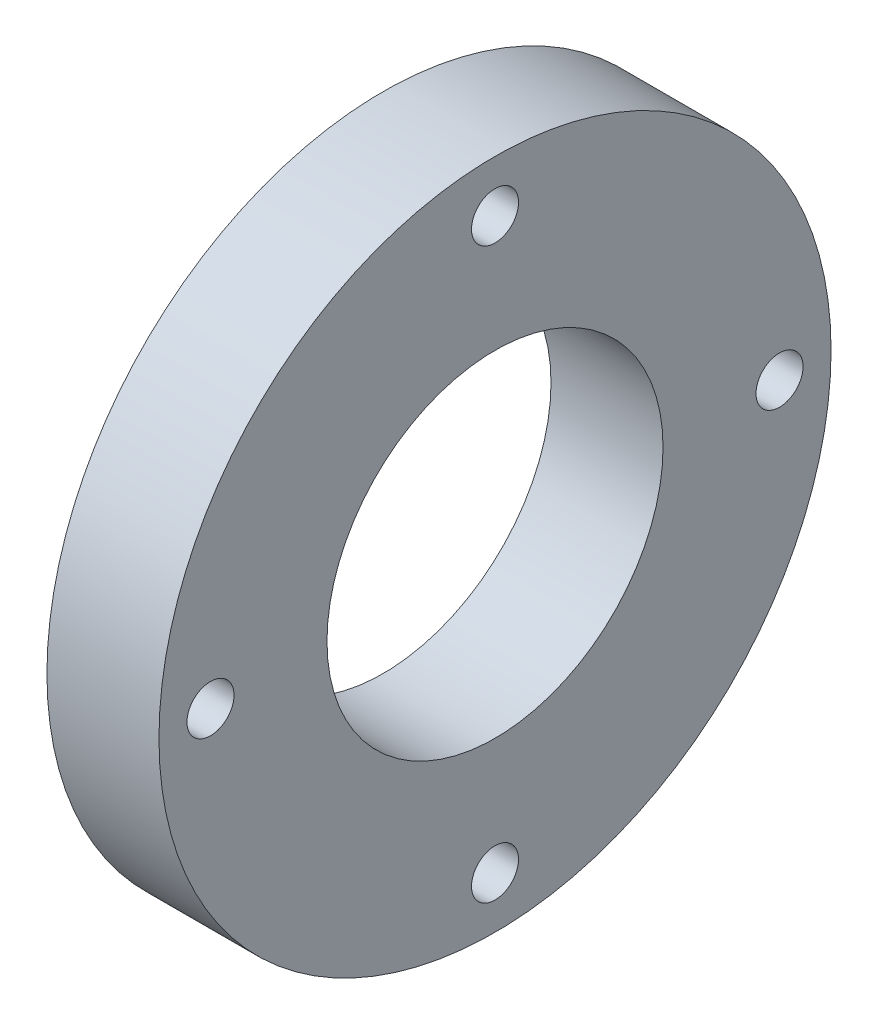
from build123d import *

# Parameters (mm, degrees)
SKETCH1_W                      = 5
SKETCH1_H                      = 15
F_15_0_15_DIAMETER_HOLE1_D     = 15
F_2_1_2_1_DIAMETER_HOLE1_D     = 2.1
F_2_1_2_1_DIAMETER_HOLE1_DEPTH = 2.5


with BuildPart() as part:
    # Sketch1 → Revolve1 (revolve)
    with BuildSketch(Plane.XY, mode=Mode.PRIVATE) as revolve1_sk:
        with Locations((23.5, 7.5)):
            Rectangle(SKETCH1_W, SKETCH1_H)
    revolve(revolve1_sk.sketch.rotate(Axis((21, 0, 0), (1, 0, 0)), 270), axis=Axis((21, 0, 0), (1, 0, 0)))

    # Ø15.0 (15) Diameter Hole1 (through all)
    with Locations(Plane.ZY.offset(-21)):
        with Locations((0, 0)):
            Hole(F_15_0_15_DIAMETER_HOLE1_D / 2)

    # Ø2.1 (2.1) Diameter Hole1
    with Locations(Plane(origin=(26, 0, 0), x_dir=(0, 0, -1), z_dir=(1, 0, 0))):
        with Locations((-12.7, 0), (12.7, 0), (0, -12.7), (0, 12.7)):
            Hole(F_2_1_2_1_DIAMETER_HOLE1_D / 2, depth=F_2_1_2_1_DIAMETER_HOLE1_DEPTH)


solid = part.part
